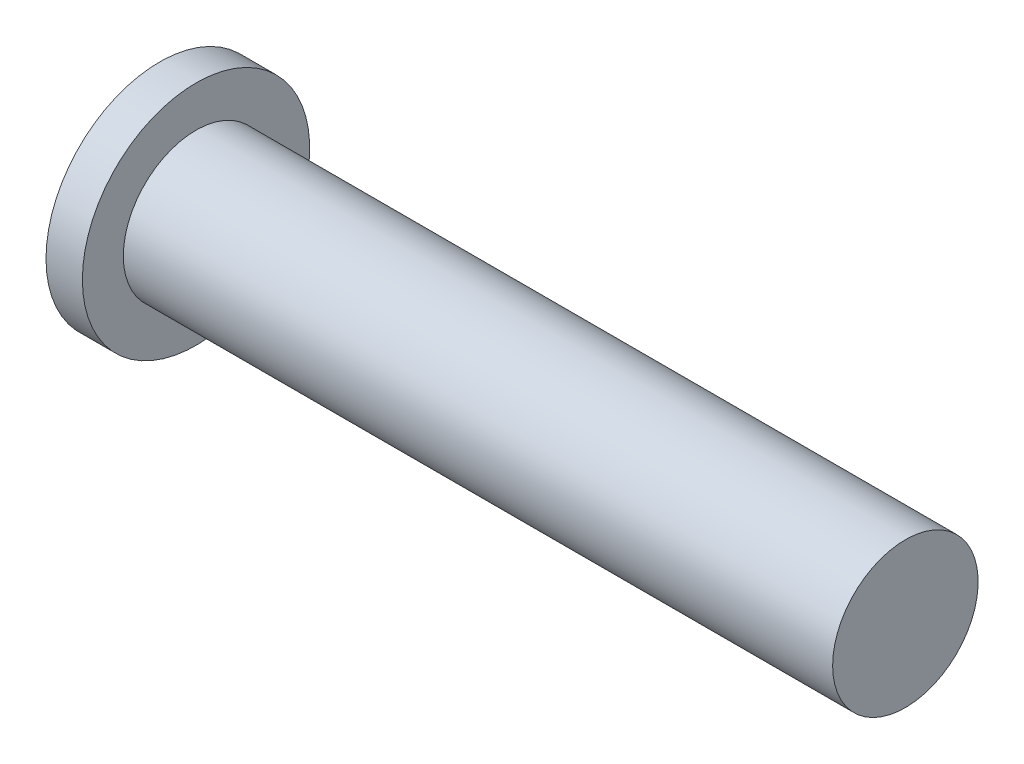
from build123d import *


with BuildPart() as part:
    # ｽｹｯﾁ1 → 回転1 (revolve)
    with BuildSketch(Plane(origin=(0, 0, 0), x_dir=(1, 0, 0), z_dir=(0, 1, 0)), mode=Mode.PRIVATE) as revolve_1_sk:
        Polygon((0, 0), (0, 6.25), (2, 6.25), (2, 4), (41, 4), (41, 0), align=None)
    revolve(revolve_1_sk.sketch.rotate(Axis((0, 0, 0), (1, 0, 0)), 180), axis=Axis((0, 0, 0), (1, 0, 0)))


solid = part.part
